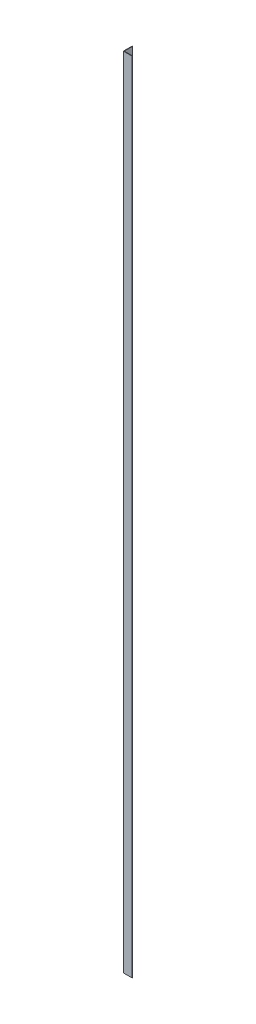
from build123d import *

# Parameters (mm, degrees)
EXTRUDE_1_DEPTH = 1800


with BuildPart() as part:
    # 스케치1 → 보스-돌출1 (new body)
    with BuildSketch(Plane(origin=(0, 0, 0), x_dir=(1, 0, 0), z_dir=(0, 1, 0))):
        Polygon((0, 20), (0, 0), (20, 0), (20, 1), (1, 1), (1, 20), align=None)
    extrude(amount=EXTRUDE_1_DEPTH)


solid = part.part
